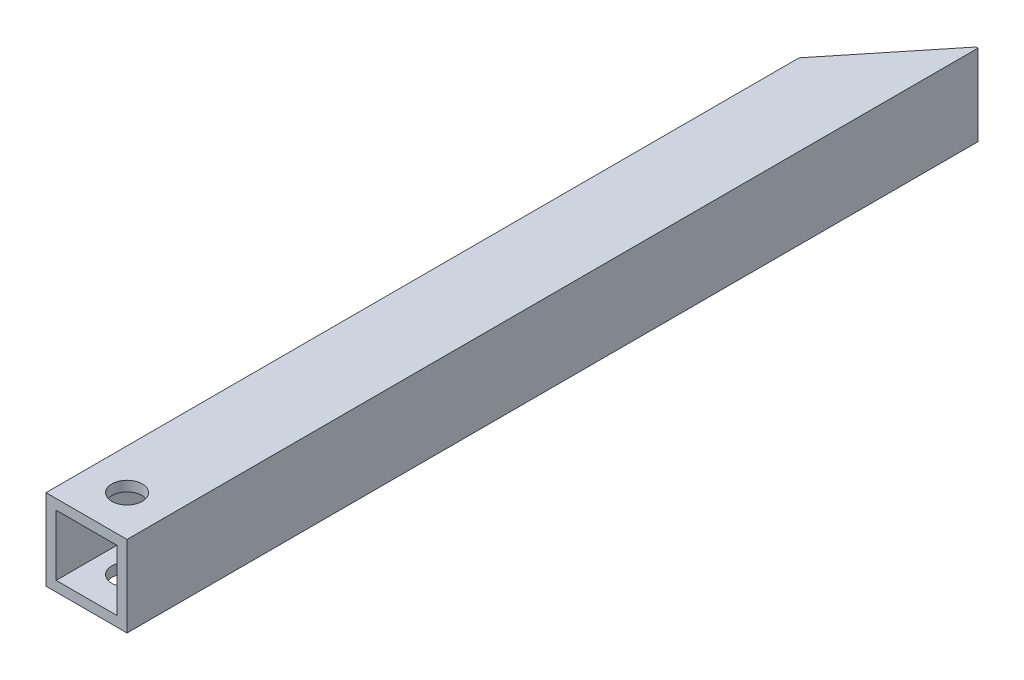
from build123d import *

# Parameters (mm, degrees)
SKETCH1_W           = 25.4
SKETCH1_H           = 25.4
SKETCH1_W_2         = 19.05
SKETCH1_H_2         = 19.05
BOSS_EXTRUDE1_DEPTH = 266.7
CUT_EXTRUDE1_DEPTH  = 270.108175275
SKETCH3_R           = 4.7625
CUT_EXTRUDE2_DEPTH  = 270.108175275


with BuildPart() as part:
    # Sketch1 → Boss-Extrude1 (new body)
    with BuildSketch(Plane.XY):
        with Locations((12.7, 12.7)):
            Rectangle(SKETCH1_W, SKETCH1_H)
        with Locations((12.7, 12.7)):
            Rectangle(SKETCH1_W_2, SKETCH1_H_2, mode=Mode.SUBTRACT)
    extrude(amount=BOSS_EXTRUDE1_DEPTH)

    # Sketch2 → Cut-Extrude1 (cut, through all)
    with BuildSketch(Plane(origin=(0, 25.4, 0), x_dir=(1, 0, 0), z_dir=(0, 1, 0))):
        Polygon((28.218627474, 4.252994852), (-38.643180904, -78.477766606), (-121.852589488, 10.228955552), (-14.467388396, 75.01098645), align=None)
    extrude(amount=-CUT_EXTRUDE1_DEPTH, mode=Mode.SUBTRACT)

    # Sketch3 → Cut-Extrude2 (cut, through all)
    with BuildSketch(Plane(origin=(0, 25.4, 0), x_dir=(1, 0, 0), z_dir=(0, 1, 0))):
        with Locations(Location((12.7, -254, 0), (0, 0, 270))):
            Circle(SKETCH3_R)
    extrude(amount=-CUT_EXTRUDE2_DEPTH, mode=Mode.SUBTRACT)


solid = part.part
